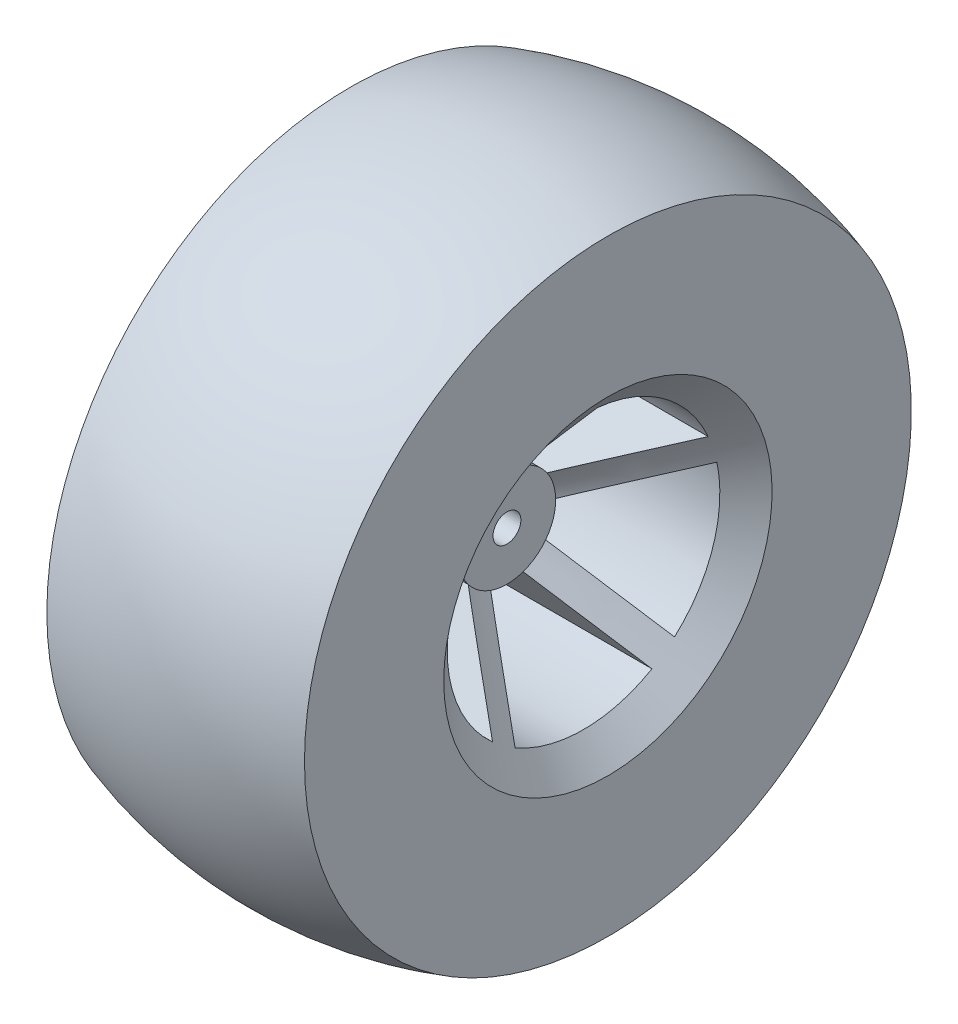
from build123d import *

# Parameters (mm, degrees)
CUT_EXTRUDE1_DEPTH      = 69.313615204
CUT_EXTRUDE1_DEPTH_BACK = 69.313615204


with BuildPart() as part:
    # Sketch1 → Revolve1 (revolve)
    with BuildSketch(Plane(origin=(0, 0, 0), x_dir=(1, 0, 0), z_dir=(0, 1, 0))):
        with BuildLine():
            Line((18.5, -43.576702778), (18.5, -23.576702778))
            Line((18.5, -23.576702778), (4, -7))
            Line((4, -7), (4, -2))
            Line((4, -2), (0, -2))
            Line((0, -2), (0, -46.5))
            ThreePointArc((0, -46.5), (9.364769974, -45.764669773), (18.5, -43.576702778))
        make_face()
    revolve(axis=Axis((-21.521301372, 0, 0), (1, 0, 0)))

    # Mirror1: part across plane


with BuildPart() as part_1:
    add(part.part)
    add(part.part.mirror(Plane(origin=(0, 0, 2), x_dir=(0, 0, 1), z_dir=(-1, 0, 0))))

    # Sketch2 → Cut-Extrude1 (cut, two sides: drawn at the far end of the back side and taken through both)
    with BuildSketch(Plane(origin=(0, 0, 0), x_dir=(0, 0, -1), z_dir=(1, 0, 0)).offset(-CUT_EXTRUDE1_DEPTH_BACK)):
        with BuildLine():
            ThreePointArc((-5.761847074, 3.975062049), (-4.114496766, 5.663118961), (-2, 6.708203932))
            Line((-2, 6.708203932), (-2, 19.474272558))
            ThreePointArc((-2, 19.474272558), (-11.506897181, 15.837885241), (-17.903099827, 7.919994206))
            Line((-17.903099827, 7.919994206), (-5.761847074, 3.975062049))
        make_face()
        with BuildLine():
            Line((2, 19.474272558), (2, 6.708203932))
            ThreePointArc((2, 6.708203932), (4.114496766, 5.663118961), (5.761847074, 3.975062049))
            Line((5.761847074, 3.975062049), (17.903099827, 7.919994206))
            ThreePointArc((17.903099827, 7.919994206), (11.506897181, 15.837885241), (2, 19.474272558))
        make_face()
        with BuildLine():
            Line((-13.064724197, -14.579446948), (-5.56101733, -4.251480479))
            ThreePointArc((-5.56101733, -4.251480479), (-6.657395614, -2.163118961), (-6.997915051, 0.170835984))
            Line((-6.997915051, 0.170835984), (-19.139167805, 4.115768141))
            ThreePointArc((-19.139167805, 4.115768141), (-18.618550745, -6.049533852), (-13.064724197, -14.579446948))
        make_face()
        with BuildLine():
            Line((19.139167805, 4.115768141), (6.997915051, 0.170835984))
            ThreePointArc((6.997915051, 0.170835984), (6.999478743, 0.085424353), (7, 0))
            ThreePointArc((7, 0), (6.630502293, -2.244201271), (5.56101733, -4.251480479))
            Line((5.56101733, -4.251480479), (13.064724197, -14.579446948))
            ThreePointArc((13.064724197, -14.579446948), (17.874723972, -7.983829569), (19.576702778, 0))
            ThreePointArc((19.576702778, 0), (19.467011727, 2.069479659), (19.139167805, 4.115768141))
        make_face()
        with BuildLine():
            Line((9.82865622, -16.930587957), (2.324949352, -6.602621488))
            ThreePointArc((2.324949352, -6.602621488), (0, -7), (-2.324949352, -6.602621488))
            Line((-2.324949352, -6.602621488), (-9.82865622, -16.930587957))
            ThreePointArc((-9.82865622, -16.930587957), (0, -19.576702778), (9.82865622, -16.930587957))
        make_face()
    extrude(amount=CUT_EXTRUDE1_DEPTH + CUT_EXTRUDE1_DEPTH_BACK, mode=Mode.SUBTRACT)


solid = part_1.part
